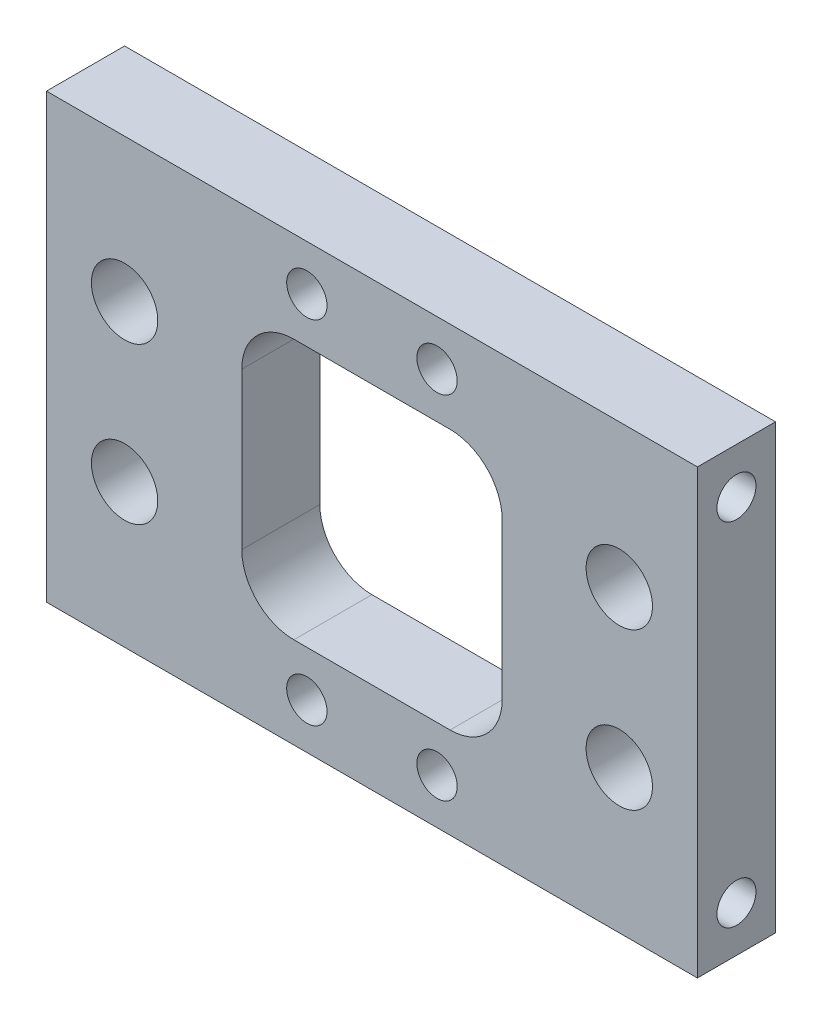
from build123d import *

# Parameters (mm, degrees)
SKETCH_1_W                = 50
SKETCH_1_H                = 34
EXTRUDE_1_DEPTH           = 6
SKETCH_2_W                = 20
SKETCH_2_H                = 20
CUT_EXTRUDE_1_DEPTH       = 31.822070015
HOLE_WIZARD_5_1_5_1_1_D   = 5.1
HOLE_WIZARD_3_0_3_1_D     = 3
HOLE_WIZARD_3_0_3_1_DEPTH = 5
HOLE_WIZARD_3_0_3_2_D     = 3
HOLE_WIZARD_3_0_3_2_DEPTH = 5
FILLET_1_R                = 4
CUT_EXTRUDE_3_REACH       = 32.822
SKETCH_9_R                = 1.55


with BuildPart() as part:
    # 草图1 → 凸台-拉伸1 (new body)
    with BuildSketch(Plane(origin=(0, 0, -3), x_dir=(-1, 0, 0), z_dir=(0, 0, -1))):
        Rectangle(SKETCH_1_W, SKETCH_1_H)
    extrude(amount=-EXTRUDE_1_DEPTH)

    # 草图2 → 切除-拉伸1 (cut, through all)
    with BuildSketch(Plane.XY.offset(3)):
        Rectangle(SKETCH_2_W, SKETCH_2_H)
    extrude(amount=-CUT_EXTRUDE_1_DEPTH, mode=Mode.SUBTRACT)

    # Ø5.1 (5.1) 直径孔1 (through all)
    with Locations(Plane(origin=(0, 0, -3), x_dir=(-1, 0, 0), z_dir=(0, 0, -1))):
        with Locations((-19, 6), (19, -6), (-19, -6), (19, 6)):
            Hole(HOLE_WIZARD_5_1_5_1_1_D / 2)

    # Ø3.0 (3) 直径孔1
    with Locations(Plane.ZY.offset(25)):
        with Locations((0, -13.5), (0, 13.5)):
            Hole(HOLE_WIZARD_3_0_3_1_D / 2, depth=HOLE_WIZARD_3_0_3_1_DEPTH)

    # Ø3.0 (3) 直径孔2
    with Locations(Plane(origin=(25, 0, 0), x_dir=(0, 0, -1), z_dir=(1, 0, 0))):
        with Locations((0, -13.5), (0, 13.5)):
            Hole(HOLE_WIZARD_3_0_3_2_D / 2, depth=HOLE_WIZARD_3_0_3_2_DEPTH)

    # 圆角1
    fillet_1_edges = [part.edges().sort_by_distance(p)[0] for p in [
        (10, 10, 0),
        (10, -10, 0),
        (-10, -10, 0),
        (-10, 10, 0),
    ]]
    fillet(fillet_1_edges, radius=FILLET_1_R)

    # 草图9 → 切除-拉伸3 (cut, up to next)
    with BuildSketch(Plane.XY.offset(3), mode=Mode.PRIVATE) as cut_extrude_3_sk1:
        with Locations((5, -13.5)):
            Circle(SKETCH_9_R)
    cut_extrude_3_tool1 = extrude(cut_extrude_3_sk1.sketch, amount=-CUT_EXTRUDE_3_REACH, mode=Mode.PRIVATE) & part.part
    # 草图9 → 切除-拉伸3 (cut, up to next)
    with BuildSketch(Plane.XY.offset(3), mode=Mode.PRIVATE) as cut_extrude_3_sk2:
        with Locations((-5, -13.5)):
            Circle(SKETCH_9_R)
    cut_extrude_3_tool2 = extrude(cut_extrude_3_sk2.sketch, amount=-CUT_EXTRUDE_3_REACH, mode=Mode.PRIVATE) & part.part
    cut_extrude_3_1 = cut_extrude_3_tool1.solids().sort_by_distance((5, -13.5, 3))[0]
    add(cut_extrude_3_1, mode=Mode.SUBTRACT)
    cut_extrude_3_2 = cut_extrude_3_tool2.solids().sort_by_distance((-5, -13.5, 3))[0]
    add(cut_extrude_3_2, mode=Mode.SUBTRACT)
    cut_extrude_3 = cut_extrude_3_1 + cut_extrude_3_2  # 切除-拉伸3 as one shape, for the pattern or mirror that repeats it

    # 镜向1: 切除-拉伸3 across plane
    add(cut_extrude_3.mirror(Plane(origin=(0, 0, 0), x_dir=(0, 0, 1), z_dir=(0, -1, 0))), mode=Mode.SUBTRACT)


solid = part.part
